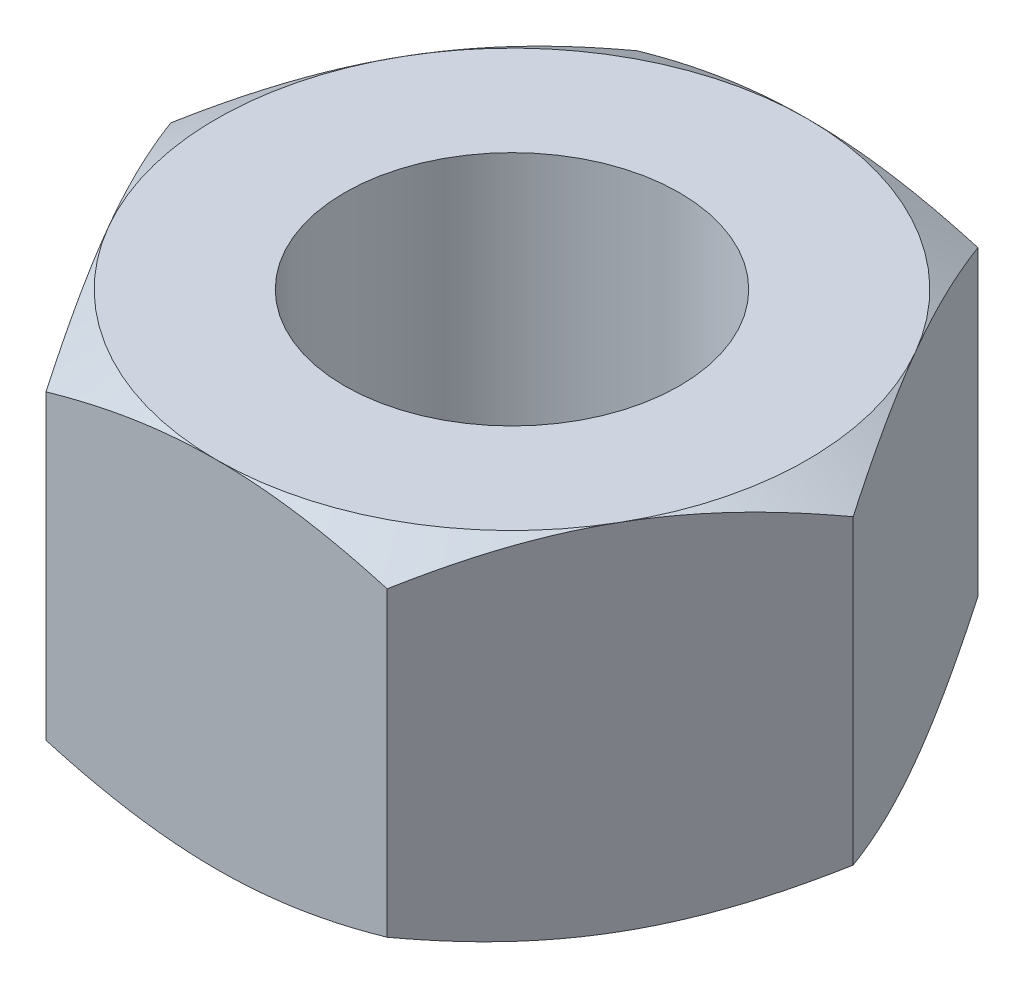
from build123d import *

# Parameters (mm, degrees)
BOSS_EXTRUDE1_DEPTH     = 5.4
M12X1_75_TAPPED_HOLE1_D = 10.2


with BuildPart() as part:
    # Sketch1 → Boss-Extrude1 (new, symmetric)
    with BuildSketch(Plane(origin=(0, 0, 0), x_dir=(1, 0, 0), z_dir=(0, 1, 0))):
        Polygon((10.392304845, 0), (5.196152423, 9), (-5.196152423, 9), (-10.392304845, 0), (-5.196152423, -9), (5.196152423, -9), align=None)
    extrude(amount=BOSS_EXTRUDE1_DEPTH, both=True)

    # Sketch2 → Cut-Revolve1 (revolve, cut)
    with BuildSketch(Plane(origin=(0, 0, 0), x_dir=(0, 0, -1), z_dir=(1, 0, 0))):
        Polygon((9, 5.4), (13.81357482, 5.4), (13.81357482, 2.620881282), align=None)
    cut_revolve1 = revolve(axis=Axis((0, 0, 0), (0, -1, 0)), mode=Mode.SUBTRACT)

    # Mirror1: Cut-Revolve1 across plane
    add(cut_revolve1.mirror(Plane.ZX), mode=Mode.SUBTRACT)

    # M12x1.75 Tapped Hole1 (through all)
    with Locations(Plane(origin=(0, 5.4, 0), x_dir=(1, 0, 0), z_dir=(0, 1, 0))):
        with Locations((0, 0)):
            Hole(M12X1_75_TAPPED_HOLE1_D / 2)


solid = part.part
